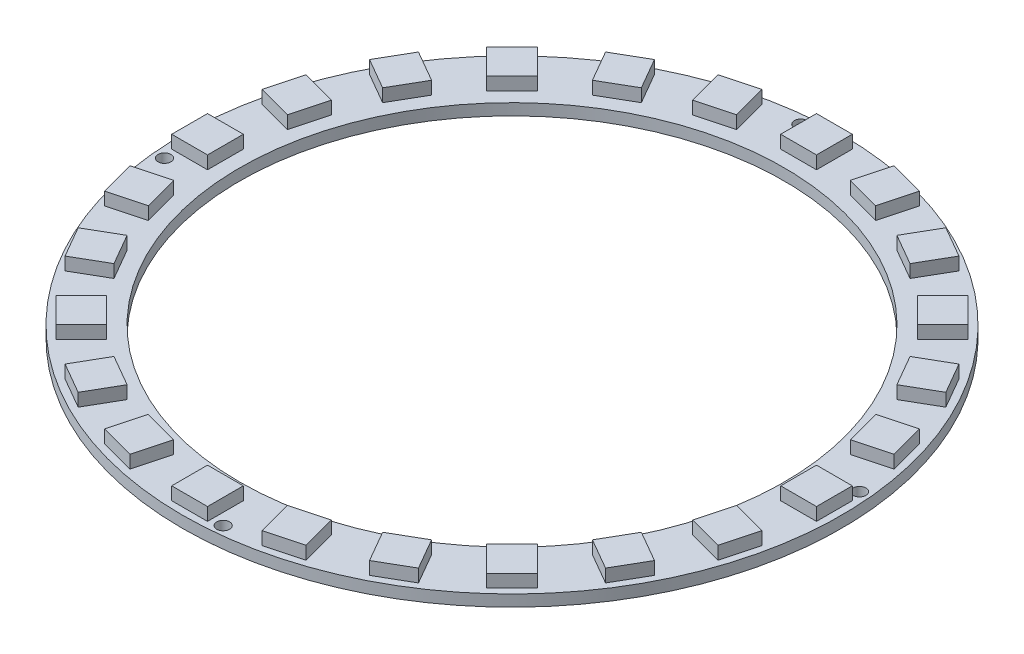
from build123d import *

# Parameters (mm, degrees)
ESQUISSE1_R             = 46
ESQUISSE1_R_2           = 38
BOSS_EXTRU_1_DEPTH      = 1.6
ESQUISSE2_R             = 0.9
ENL_V_MAT_EXTRU_1_DEPTH = 1.6
ESQUISSE3_W             = 5
ESQUISSE3_H             = 5
BOSS_EXTRU_2_DEPTH      = 1.8


with BuildPart() as part:
    # Esquisse1 → Boss.-Extru.1 (new body)
    with BuildSketch(Plane(origin=(0, 0, 0), x_dir=(1, 0, 0), z_dir=(0, 1, 0))):
        with Locations(Location((0, 0, 0), (0, 0, 270))):
            Circle(ESQUISSE1_R)
        with Locations(Location((0, 0, 0), (0, 0, 270))):
            Circle(ESQUISSE1_R_2, mode=Mode.SUBTRACT)
    extrude(amount=BOSS_EXTRU_1_DEPTH)

    # Esquisse2 → Enlèv. mat.-Extru.1 (cut)
    with BuildSketch(Plane(origin=(0, 1.6, 0), x_dir=(1, 0, 0), z_dir=(0, 1, 0))):
        with Locations(Location((-4.094938915, 44.411614194, 0), (0, 0, 270))):
            Circle(ESQUISSE2_R)
        with Locations(Location((44.411614194, 4.094938915, 0), (0, 0, 270))):
            Circle(ESQUISSE2_R)
        with Locations(Location((4.094938915, -44.411614194, 0), (0, 0, 270))):
            Circle(ESQUISSE2_R)
        with Locations(Location((-44.411614194, -4.094938915, 0), (0, 0, 270))):
            Circle(ESQUISSE2_R)
    extrude(amount=-ENL_V_MAT_EXTRU_1_DEPTH, mode=Mode.SUBTRACT)

    # Esquisse3 → Boss.-Extru.2 (add)
    with BuildSketch(Plane(origin=(0, 1.6, 0), x_dir=(1, 0, 0), z_dir=(0, 1, 0))):
        with Locations((0, 42.5)):
            Rectangle(ESQUISSE3_W, ESQUISSE3_H)
        Polygon((9.232042464, 44.113709796), (14.061671595, 42.81961457), (12.76757637, 37.989985439), (7.937947238, 39.284080664), align=None)
        Polygon((20.334936491, 40.22114317), (24.665063509, 37.72114317), (22.165063509, 33.391016151), (17.834936491, 35.891016151), align=None)
        Polygon((30.0520382, 33.587572106), (33.587572106, 30.0520382), (30.0520382, 26.516504294), (26.516504294, 30.0520382), align=None)
        Polygon((37.72114317, 24.665063509), (40.22114317, 20.334936491), (35.891016151, 17.834936491), (33.391016151, 22.165063509), align=None)
        Polygon((42.81961457, 14.061671595), (44.113709796, 9.232042464), (39.284080664, 7.937947238), (37.989985439, 12.76757637), align=None)
        with Locations((42.5, 0)):
            Rectangle(ESQUISSE3_W, ESQUISSE3_H)
        Polygon((44.113709796, -9.232042464), (42.81961457, -14.061671595), (37.989985439, -12.76757637), (39.284080664, -7.937947238), align=None)
        Polygon((40.22114317, -20.334936491), (37.72114317, -24.665063509), (33.391016151, -22.165063509), (35.891016151, -17.834936491), align=None)
        Polygon((33.587572106, -30.0520382), (30.0520382, -33.587572106), (26.516504294, -30.0520382), (30.0520382, -26.516504294), align=None)
        Polygon((24.665063509, -37.72114317), (20.334936491, -40.22114317), (17.834936491, -35.891016151), (22.165063509, -33.391016151), align=None)
        Polygon((14.061671595, -42.81961457), (9.232042464, -44.113709796), (7.937947238, -39.284080664), (12.76757637, -37.989985439), align=None)
        with Locations((0, -42.5)):
            Rectangle(ESQUISSE3_W, ESQUISSE3_H)
        Polygon((-9.232042464, -44.113709796), (-14.061671595, -42.81961457), (-12.76757637, -37.989985439), (-7.937947238, -39.284080664), align=None)
        Polygon((-20.334936491, -40.22114317), (-24.665063509, -37.72114317), (-22.165063509, -33.391016151), (-17.834936491, -35.891016151), align=None)
        Polygon((-30.0520382, -33.587572106), (-33.587572106, -30.0520382), (-30.0520382, -26.516504294), (-26.516504294, -30.0520382), align=None)
        Polygon((-37.72114317, -24.665063509), (-40.22114317, -20.334936491), (-35.891016151, -17.834936491), (-33.391016151, -22.165063509), align=None)
        Polygon((-42.81961457, -14.061671595), (-44.113709796, -9.232042464), (-39.284080664, -7.937947238), (-37.989985439, -12.76757637), align=None)
        with Locations((-42.5, 0)):
            Rectangle(ESQUISSE3_W, ESQUISSE3_H)
        Polygon((-44.113709796, 9.232042464), (-42.81961457, 14.061671595), (-37.989985439, 12.76757637), (-39.284080664, 7.937947238), align=None)
        Polygon((-40.22114317, 20.334936491), (-37.72114317, 24.665063509), (-33.391016151, 22.165063509), (-35.891016151, 17.834936491), align=None)
        Polygon((-33.587572106, 30.0520382), (-30.0520382, 33.587572106), (-26.516504294, 30.0520382), (-30.0520382, 26.516504294), align=None)
        Polygon((-24.665063509, 37.72114317), (-20.334936491, 40.22114317), (-17.834936491, 35.891016151), (-22.165063509, 33.391016151), align=None)
        Polygon((-14.061671595, 42.81961457), (-9.232042464, 44.113709796), (-7.937947238, 39.284080664), (-12.76757637, 37.989985439), align=None)
    extrude(amount=BOSS_EXTRU_2_DEPTH)


solid = part.part
